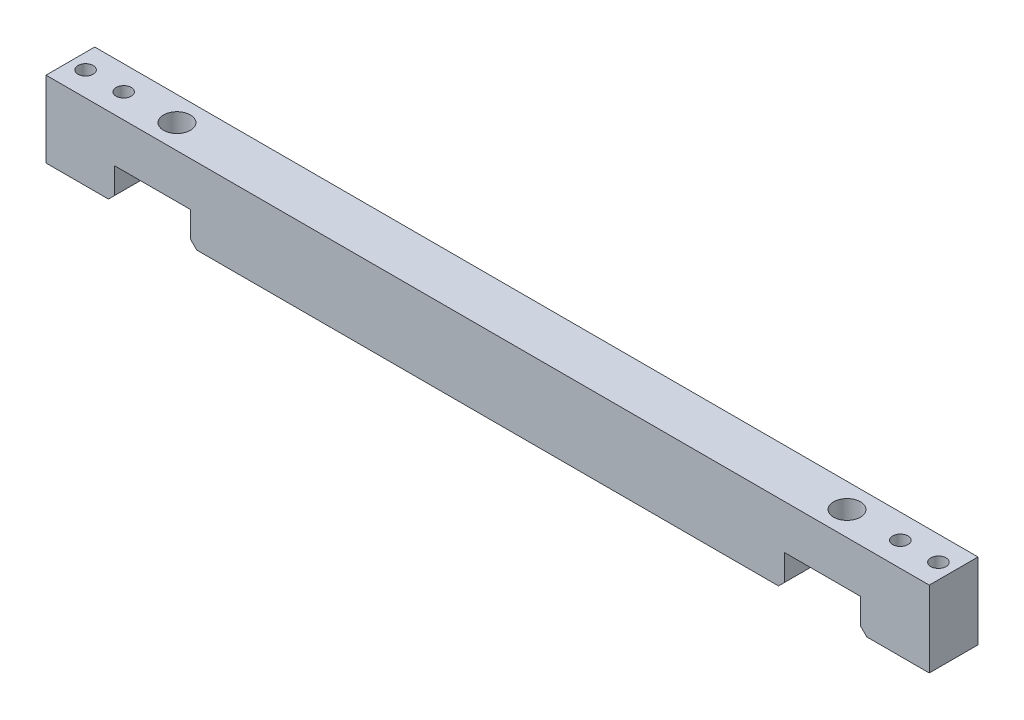
from build123d import *

# Parameters (mm, degrees)
SKETCH1_W                = 290
SKETCH1_H                = 16
BOSS_EXTRUDE1_DEPTH      = 12.5
M5_TAPPED_HOLE1_D        = 4.2
SKETCH7_W                = 25
SKETCH7_H                = 24.547818694
CUT_EXTRUDE2_DEPTH       = 147.414650906
CHAMFER1_SIZE            = 2
CHAMFER1_OF_MIRROR1_SIZE = 2
G1_8_TAPPED_HOLE1_D      = 8.8
G1_8_TAPPED_HOLE1_DEPTH  = 9
G1_8_TAPPED_HOLE1_TIP    = 2.643786724
M6_TAPPED_HOLE1_D        = 5
M6_TAPPED_HOLE1_DEPTH    = 15
M6_TAPPED_HOLE1_TIP      = 1.502151548


with BuildPart() as part:
    # Sketch1 → Boss-Extrude1 (new, symmetric)
    with BuildSketch(Plane(origin=(0, 0, 0), x_dir=(1, 0, 0), z_dir=(0, 1, 0))):
        Rectangle(SKETCH1_W, SKETCH1_H)
    extrude(amount=BOSS_EXTRUDE1_DEPTH, both=True)

    # M5 Tapped Hole1 (through all)
    with Locations(Plane(origin=(0, 12.5, 0), x_dir=(1, 0, 0), z_dir=(0, 1, 0))):
        with Locations((-110, 0), (110, 0)):
            Hole(M5_TAPPED_HOLE1_D / 2)

    # Sketch7 → Cut-Extrude2 (cut, through all)
    with BuildSketch(Plane.XY.offset(8)):
        with Locations((110, -14.273909347)):
            Rectangle(SKETCH7_W, SKETCH7_H)
    cut_extrude2 = extrude(amount=-CUT_EXTRUDE2_DEPTH, mode=Mode.SUBTRACT)

    # Chamfer1
    chamfer1_edges = [part.edges().sort_by_distance(p)[0] for p in [
        (122.5, -12.5, 0),
        (97.5, -12.5, 0),
    ]]
    chamfer(chamfer1_edges, length=CHAMFER1_SIZE)

    # Mirror1: Cut-Extrude2 across plane
    add(cut_extrude2.mirror(Plane(origin=(0, 0, 0), x_dir=(0, 0, 1), z_dir=(1, 0, 0))), mode=Mode.SUBTRACT)

    # Chamfer1 of Mirror1
    chamfer1_of_mirror1_edges = [part.edges().sort_by_distance(p)[0] for p in [
        (-122.5, -12.5, 0),
        (-97.5, -12.5, 0),
    ]]
    chamfer(chamfer1_of_mirror1_edges, length=CHAMFER1_OF_MIRROR1_SIZE)

    # G1/8 Tapped Hole1
    with Locations(Plane(origin=(0, 12.5, 0), x_dir=(1, 0, 0), z_dir=(0, 1, 0))):
        with Locations((-110, 0), (110, 0)):
            Hole(G1_8_TAPPED_HOLE1_D / 2, depth=G1_8_TAPPED_HOLE1_DEPTH)
            with Locations((0, 0, -(G1_8_TAPPED_HOLE1_DEPTH + G1_8_TAPPED_HOLE1_TIP / 2))):  # 118° drill point
                Cone(0, G1_8_TAPPED_HOLE1_D / 2, G1_8_TAPPED_HOLE1_TIP, mode=Mode.SUBTRACT)

    # M6 Tapped Hole1
    with Locations(Plane(origin=(0, 12.5, 0), x_dir=(1, 0, 0), z_dir=(0, 1, 0))):
        with Locations((-140, 0), (-127.5, 0), (127.5, 0), (140, 0)):
            Hole(M6_TAPPED_HOLE1_D / 2, depth=M6_TAPPED_HOLE1_DEPTH)
            with Locations((0, 0, -(M6_TAPPED_HOLE1_DEPTH + M6_TAPPED_HOLE1_TIP / 2))):  # 118° drill point
                Cone(0, M6_TAPPED_HOLE1_D / 2, M6_TAPPED_HOLE1_TIP, mode=Mode.SUBTRACT)


solid = part.part
